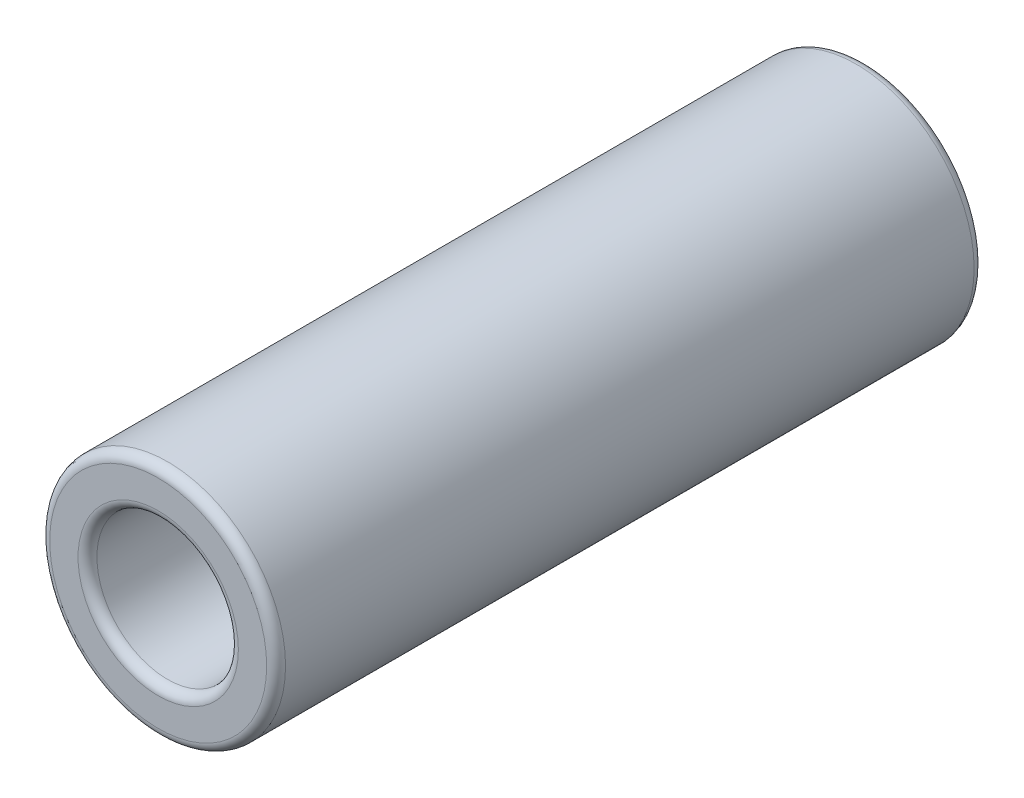
from build123d import *

# Parameters (mm, degrees)
SKETCH1_R           = 2.5
SKETCH1_R_2         = 1.5
BOSS_EXTRUDE1_DEPTH = 15
FILLET1_R           = 0.2


with BuildPart() as part:
    # Sketch1 → Boss-Extrude1 (new body)
    with BuildSketch(Plane.XY):
        Circle(SKETCH1_R)
        Circle(SKETCH1_R_2, mode=Mode.SUBTRACT)
    extrude(amount=BOSS_EXTRUDE1_DEPTH)

    # Fillet1
    fillet1_edges = [part.edges().sort_by_distance(p)[0] for p in [
        (-2.5, 0, 0),
        (-2.5, 0, 15),
        (-1.5, 0, 0),
        (-1.5, 0, 15),
    ]]
    fillet(fillet1_edges, radius=FILLET1_R)


solid = part.part
